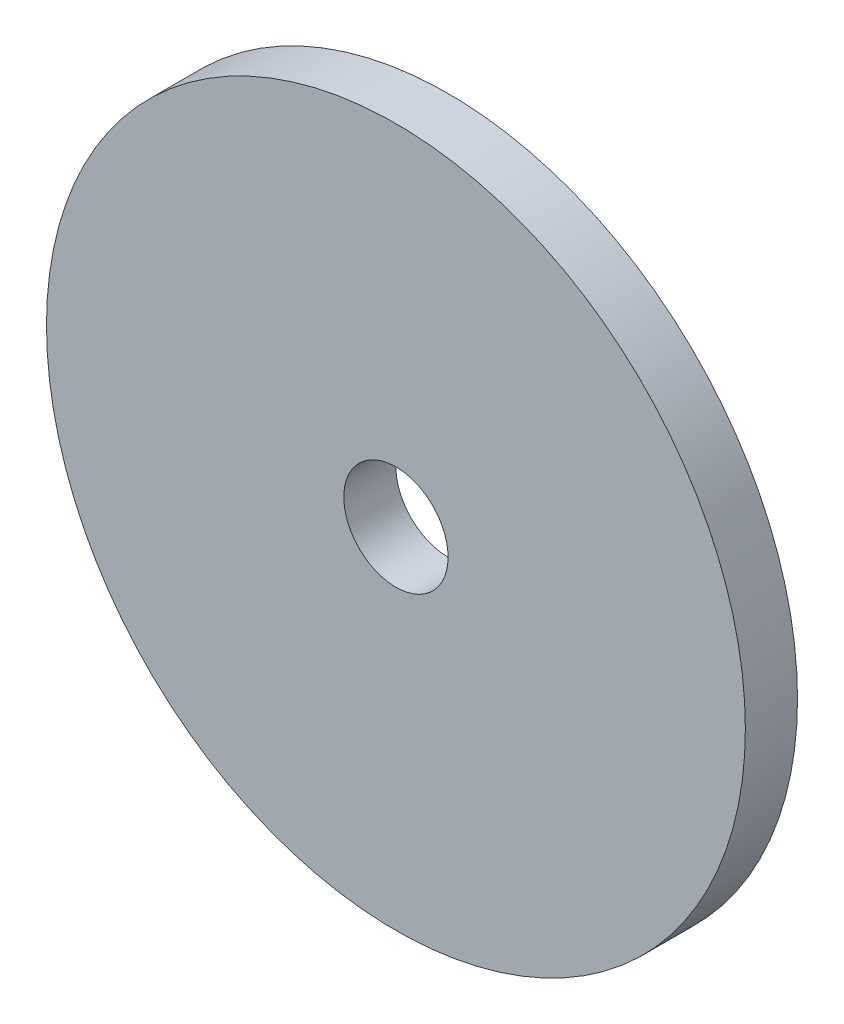
from build123d import *

# Parameters (mm, degrees)
SKETCH2_R           = 33.5
BOSS_EXTRUDE1_DEPTH = 5
SKETCH3_R           = 5
CUT_EXTRUDE1_DEPTH  = 48.639269516


with BuildPart() as part:
    # Sketch2 → Boss-Extrude1 (new body)
    with BuildSketch(Plane.XY):
        Circle(SKETCH2_R)
    extrude(amount=BOSS_EXTRUDE1_DEPTH)

    # Sketch3 → Cut-Extrude1 (cut, through all)
    with BuildSketch(Plane.XY.offset(5)):
        Circle(SKETCH3_R)
    extrude(amount=-CUT_EXTRUDE1_DEPTH, mode=Mode.SUBTRACT)


solid = part.part
